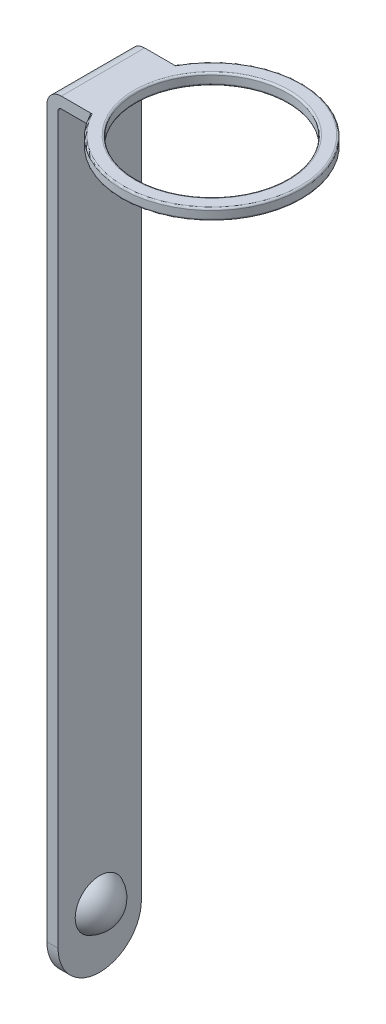
from build123d import *

# Parameters (mm, degrees)
RESSALTO_EXTRUS_O1_DEPTH   = 2.32
CORTE_EXTRUS_O1_DEPTH      = 2.32
FILETE1_R                  = 0.2
RESSALTO_EXTRUS_O2_DEPTH   = 0.1
RESSALTO_EXTRUS_O2_2_DEPTH = 0.1
RESSALTO_EXTRUS_O2_3_DEPTH = 0.1
RESSALTO_EXTRUS_O2_4_DEPTH = 0.1
RESSALTO_EXTRUS_O2_5_DEPTH = 0.1
RESSALTO_EXTRUS_O2_6_DEPTH = 0.1
RESSALTO_EXTRUS_O2_7_DEPTH = 0.1
RESSALTO_EXTRUS_O2_8_DEPTH = 0.1
RESSALTO_EXTRUS_O2_9_DEPTH = 0.1
ESCALA1_SCALE              = 0.85


with BuildPart() as part:
    # Esboço1 → Revolução1 (revolve)
    with BuildSketch(Plane.XY, mode=Mode.PRIVATE) as revolu_o1_sk:
        with BuildLine():
            Line((-4.92, 0), (-4.32, 0))
            ThreePointArc((-4.32, 0), (-4.249289322, -0.029289322), (-4.22, -0.1))
            Line((-4.22, -0.1), (-4.22, -0.52))
            ThreePointArc((-4.22, -0.52), (-4.249289322, -0.590710678), (-4.32, -0.62))
            Line((-4.32, -0.62), (-4.92, -0.62))
            ThreePointArc((-4.92, -0.62), (-4.990710678, -0.590710678), (-5.02, -0.52))
            Line((-5.02, -0.52), (-5.02, -0.1))
            ThreePointArc((-5.02, -0.1), (-4.990710678, -0.029289322), (-4.92, 0))
        make_face()
    revolve(revolu_o1_sk.sketch.rotate(Axis((0, 0, 0), (0, -1, 0)), 270), axis=Axis((0, 0, 0), (0, -1, 0)))

    # Esboço2 → Ressalto-extrusão1 (add, symmetric)
    with BuildSketch(Plane.XY):
        with BuildLine():
            Line((-4.32, 0), (-6.06, 0))
            ThreePointArc((-6.06, 0), (-6.625685425, -0.234314575), (-6.86, -0.8))
            Line((-6.86, -0.8), (-6.86, -43.5))
            Line((-6.86, -43.5), (-6.24, -43.5))
            Line((-6.24, -43.5), (-6.24, -0.8))
            ThreePointArc((-6.24, -0.8), (-6.187279221, -0.672720779), (-6.06, -0.62))
            Line((-6.06, -0.62), (-4.32, -0.62))
            Line((-4.32, -0.62), (-4.32, 0))
        make_face()
    extrude(amount=RESSALTO_EXTRUS_O1_DEPTH, both=True)

    # Esboço3 → Corte-extrusão1 (cut, symmetric)
    with BuildSketch(Plane.ZY.offset(6.86)):
        with BuildLine():
            Line((-2.32, -41.18), (-5, -41.18))
            Line((-5, -41.18), (-5, -44.5))
            Line((-5, -44.5), (5, -44.5))
            Line((5, -44.5), (5, -41.18))
            Line((5, -41.18), (2.32, -41.18))
            ThreePointArc((2.32, -41.18), (0, -43.5), (-2.32, -41.18))
        make_face()
    extrude(amount=CORTE_EXTRUS_O1_DEPTH, both=True, mode=Mode.SUBTRACT)

    # Esboço4 → Revolução2 (revolve)
    with BuildSketch(Plane.XY):
        with BuildLine():
            Line((-6.24, -40.2), (-5.34, -40.2))
            ThreePointArc((-5.34, -40.2), (-5.58525, -41.0175), (-6.24, -41.565))
            Line((-6.24, -41.565), (-6.46, -41.565))
            Line((-6.46, -41.565), (-6.46, -40.2))
            Line((-6.46, -40.2), (-6.24, -40.2))
        make_face()
    revolve(axis=Axis((-6.24, -40.2, 0), (1, 0, 0)))

    # Esboço5 → Corte-Revolução1 (revolve, cut)
    with BuildSketch(Plane.XY):
        with BuildLine():
            Line((-6.548633208, -41.145528188), (-7.178811476, -41.32980521))
            Line((-7.178811476, -41.32980521), (-7.176947214, -40.2))
            Line((-7.176947214, -40.2), (-5.84, -40.2))
            ThreePointArc((-5.84, -40.2), (-6.036819779, -40.790801273), (-6.548633208, -41.145528188))
        make_face()
    revolve(axis=Axis((-5.84, -40.2, 0), (-1, 0, 0)), mode=Mode.SUBTRACT)

    # Filete1
    filete1_edges = [part.edges().sort_by_distance(p)[0] for p in [
        (-6.86, -39.16342179, 0),
    ]]
    fillet(filete1_edges, radius=FILETE1_R)


with BuildPart() as body_2:
    # Esboço7 → Ressalto-extrusão2 (new, symmetric)
    with BuildSketch(Plane.ZY.offset(6.86)):
        with BuildLine():
            Line((1.020851484, -19.865331757), (0.742596737, -19.76920739))
            add(Edge.make_bspline(
                [(0.742596737, -19.76920739), (0.757593957, -19.806355131), (0.786687829, -19.878419925), (0.825031677, -19.984742232), (0.857678095, -20.085518966), (0.884393745, -20.180849175), (0.90520856, -20.27059076), (0.920147156, -20.354857607), (0.929573432, -20.433711748), (0.930856164, -20.484636158), (0.931472686, -20.509112057)],
                knots=[0, 0, 0, 0, 0.156478262, 0.303560144, 0.441403194, 0.570198865, 0.690181929, 0.801102155, 0.904403337, 1, 1, 1, 1], degree=3))
            add(Edge.make_bspline(
                [(0.931472686, -20.509112057), (0.930863484, -20.533599164), (0.929688427, -20.580831029), (0.919659265, -20.648690082), (0.90243485, -20.710357768), (0.878400099, -20.765868408), (0.847209355, -20.81505198), (0.809364233, -20.858194841), (0.764244027, -20.894866274), (0.712604498, -20.92533672), (0.654422599, -20.948414271), (0.590471733, -20.964116777), (0.520743778, -20.971290684), (0.44547422, -20.971022615), (0.364479407, -20.963236419), (0.278056645, -20.947153581), (0.185734386, -20.924015136), (0.123279398, -20.903178626), (0.090806072, -20.892344732)],
                knots=[0, 0, 0, 0, 0.064741831, 0.12487704, 0.18088471, 0.233644607, 0.284273212, 0.334308944, 0.384755763, 0.437409504, 0.492280856, 0.54970497, 0.611027667, 0.677187925, 0.748494668, 0.825921597, 0.909488339, 1, 1, 1, 1], degree=3))
            add(Edge.make_bspline(
                [(0.090806072, -20.892344732), (0.056650445, -20.880073255), (-0.010213215, -20.856050394), (-0.105896758, -20.81442944), (-0.195604581, -20.770351986), (-0.278880492, -20.722693472), (-0.35574384, -20.671648161), (-0.426513389, -20.617495695), (-0.491298393, -20.560371112), (-0.548882041, -20.499414701), (-0.600619058, -20.436654781), (-0.645397844, -20.371796368), (-0.682966188, -20.305171044), (-0.714727722, -20.237488229), (-0.738770659, -20.167781459), (-0.755441338, -20.096407833), (-0.766651633, -20.023644123), (-0.767821803, -19.974426924), (-0.768410858, -19.949651377)],
                knots=[0, 0, 0, 0, 0.079810182, 0.156237826, 0.22936628, 0.299567533, 0.36712409, 0.432164324, 0.495441274, 0.556879497, 0.616406191, 0.67419565, 0.729981172, 0.784472221, 0.838432893, 0.891814982, 0.945540522, 1, 1, 1, 1], degree=3))
            add(Edge.make_bspline(
                [(-0.768410858, -19.949651377), (-0.767960921, -19.929822007), (-0.767011201, -19.887966417), (-0.760157699, -19.821984823), (-0.749596434, -19.749554797), (-0.73461293, -19.670558166), (-0.715598755, -19.585083339), (-0.692283055, -19.493171966), (-0.664819841, -19.394786041), (-0.64418831, -19.327328524), (-0.633499466, -19.292379937)],
                knots=[0, 0, 0, 0, 0.088369929, 0.186530149, 0.295393245, 0.414553327, 0.544787577, 0.685609019, 0.837119402, 1, 1, 1, 1], degree=3))
            Line((-0.633499466, -19.292379937), (-0.947168453, -19.184029225))
            add(Edge.make_bspline(
                [(-0.947168453, -19.184029225), (-0.954496888, -19.21575444), (-0.96889101, -19.278067416), (-0.987316093, -19.370313016), (-1.003050969, -19.459277237), (-1.015581551, -19.544926988), (-1.025950312, -19.627265243), (-1.03305992, -19.706432132), (-1.037543469, -19.782364577), (-1.038007205, -19.831879156), (-1.038233643, -19.856056599)],
                knots=[0, 0, 0, 0, 0.143721631, 0.28229036, 0.415178753, 0.542474965, 0.66435352, 0.781452797, 0.893285726, 1, 1, 1, 1], degree=3))
            add(Edge.make_bspline(
                [(-1.038233643, -19.856056599), (-1.037372979, -19.896993805), (-1.035670243, -19.977983946), (-1.021212955, -20.097360542), (-0.998761011, -20.213251995), (-0.966072598, -20.325015148), (-0.924566678, -20.433212504), (-0.873964723, -20.537555307), (-0.81358392, -20.637942545), (-0.74455896, -20.734162161), (-0.667533141, -20.825731644), (-0.582317812, -20.911116288), (-0.489876772, -20.99051113), (-0.389723132, -21.063586009), (-0.282654271, -21.131166291), (-0.167810221, -21.192208076), (-0.04590438, -21.247935345), (0.039416301, -21.278837702), (0.082795709, -21.29454932)],
                knots=[0, 0, 0, 0, 0.062770809, 0.124185723, 0.184171926, 0.243656045, 0.302541562, 0.361734005, 0.421287993, 0.482002513, 0.543190042, 0.604615169, 0.666829468, 0.729904136, 0.794611786, 0.860862787, 0.929258769, 1, 1, 1, 1], degree=3))
            add(Edge.make_bspline(
                [(0.082795709, -21.29454932), (0.104667683, -21.302015478), (0.147624593, -21.316679131), (0.211646496, -21.335540827), (0.273815662, -21.351647393), (0.334014839, -21.365020438), (0.392262556, -21.376473927), (0.44879566, -21.383515864), (0.503282228, -21.389693812), (0.556090338, -21.391212691), (0.606908994, -21.391912093), (0.655831726, -21.387924403), (0.702981861, -21.383072477), (0.748121937, -21.373922314), (0.791345399, -21.362534599), (0.832753796, -21.348783038), (0.872199645, -21.331773307), (0.909643668, -21.311952677), (0.945139098, -21.289699914), (0.978186811, -21.264614158), (1.009050678, -21.237120667), (1.037810206, -21.207208799), (1.064116233, -21.174432032), (1.088006028, -21.13914032), (1.109613696, -21.10132392), (1.128979836, -21.061151363), (1.146424733, -21.018433311), (1.161032496, -20.973008562), (1.173059092, -20.925040061), (1.183873511, -20.87477936), (1.191704631, -20.821822264), (1.197084184, -20.766235738), (1.200507574, -20.708289395), (1.201029868, -20.668761997), (1.201295471, -20.648661029)],
                knots=[0, 0, 0, 0, 0.043008507, 0.084469397, 0.124180755, 0.162507098, 0.199235706, 0.234597893, 0.268508446, 0.301228061, 0.332875341, 0.363026025, 0.392516044, 0.421035546, 0.448632244, 0.475678105, 0.502156506, 0.52848074, 0.554458372, 0.580037958, 0.605602831, 0.631315783, 0.657171999, 0.683722641, 0.710551374, 0.738157985, 0.766667892, 0.79636134, 0.826874001, 0.858677607, 0.892005197, 0.92643625, 0.96259044, 1, 1, 1, 1], degree=3))
            add(Edge.make_bspline(
                [(1.201295471, -20.648661029), (1.200693782, -20.616882032), (1.199483041, -20.552935124), (1.190643247, -20.456672676), (1.176900327, -20.359511702), (1.156843715, -20.261764126), (1.131682563, -20.163309348), (1.10000971, -20.064437228), (1.063700571, -19.964532602), (1.035240248, -19.898643496), (1.020851484, -19.865331757)],
                knots=[0, 0, 0, 0, 0.117722206, 0.236885105, 0.357859754, 0.481103153, 0.606371041, 0.734148831, 0.865592885, 1, 1, 1, 1], degree=3))
        make_face()
    extrude(amount=RESSALTO_EXTRUS_O2_DEPTH, both=True)


with BuildPart() as body_3:
    # Esboço7 → Ressalto-extrus_o2 2 (new, symmetric)
    with BuildSketch(Plane.ZY.offset(6.86)):
        Polygon((1.147330914, -17.183967833), (1.147330914, -16.860180491), (-0.573632535, -16.264462374), (1.012419522, -16.324329304), (1.012419522, -15.984942833), (-0.483410541, -14.946546709), (1.147330914, -15.511066567), (1.147330914, -15.160296947), (-0.984269086, -14.422078671), (-0.984269086, -14.849157548), (0.599674981, -15.988737216), (-0.984269086, -15.973138086), (-0.984269086, -16.445749557), align=None)
    extrude(amount=RESSALTO_EXTRUS_O2_2_DEPTH, both=True)


with BuildPart() as body_4:
    # Esboço7 → Ressalto-extrus_o2 3 (new, symmetric)
    with BuildSketch(Plane.ZY.offset(6.86)):
        with BuildLine():
            Line((1.147330914, -14.647633656), (1.147330914, -14.269881757))
            Line((1.147330914, -14.269881757), (0.310880281, -13.980243861))
            Line((0.310880281, -13.980243861), (0.310880281, -13.904777801))
            add(Edge.make_bspline(
                [(0.310880281, -13.904777801), (0.310361373, -13.870045477), (0.309340534, -13.801717191), (0.29986038, -13.701139008), (0.284264456, -13.604403601), (0.262846316, -13.511210694), (0.235037933, -13.421874099), (0.201154893, -13.336152333), (0.161134695, -13.254148986), (0.114634652, -13.17645402), (0.063689237, -13.103051479), (0.007103352, -13.036035766), (-0.05255704, -12.974035198), (-0.117244837, -12.918562648), (-0.185805634, -12.868723312), (-0.259033883, -12.825179927), (-0.33594974, -12.786823917), (-0.390033182, -12.766821107), (-0.41721964, -12.756766171)],
                knots=[0, 0, 0, 0, 0.071615387, 0.14088768, 0.208118212, 0.273570435, 0.337921911, 0.400890572, 0.463496012, 0.525875639, 0.587465896, 0.64754421, 0.706571715, 0.764728301, 0.823049311, 0.881153877, 0.940258887, 1, 1, 1, 1], degree=3))
            add(Edge.make_bspline(
                [(-0.41721964, -12.756766171), (-0.435965533, -12.750571497), (-0.47213139, -12.738620308), (-0.526033755, -12.72600555), (-0.577313408, -12.717799326), (-0.626002077, -12.714172577), (-0.672228632, -12.71586746), (-0.715759795, -12.722172289), (-0.757010458, -12.732773229), (-0.782451454, -12.744049632), (-0.794971538, -12.749599004)],
                knots=[0, 0, 0, 0, 0.152709627, 0.294617841, 0.427812724, 0.554257621, 0.671783736, 0.784973558, 0.894180667, 1, 1, 1, 1], degree=3))
            add(Edge.make_bspline(
                [(-0.794971538, -12.749599004), (-0.803266079, -12.753862369), (-0.819800159, -12.762360829), (-0.842014125, -12.779272715), (-0.863044524, -12.798002962), (-0.882445467, -12.819269539), (-0.899221094, -12.843853652), (-0.914910389, -12.870379375), (-0.928891575, -12.899523725), (-0.940593812, -12.931671993), (-0.951297243, -12.966795958), (-0.959910109, -13.005746775), (-0.967453043, -13.048370304), (-0.973833008, -13.094765326), (-0.978281612, -13.145142642), (-0.981600618, -13.199268322), (-0.983737646, -13.257327089), (-0.984087862, -13.297253053), (-0.984269086, -13.317913244)],
                knots=[0, 0, 0, 0, 0.044358331, 0.088422526, 0.132522324, 0.178513533, 0.225143808, 0.274068847, 0.325286517, 0.378895433, 0.436942126, 0.500133654, 0.568833053, 0.643175244, 0.723202219, 0.809751832, 0.901553696, 1, 1, 1, 1], degree=3))
            Line((-0.984269086, -13.317913244), (-0.984269086, -13.90941538))
            Line((-0.984269086, -13.90941538), (1.147330914, -14.647633656))
        make_face()
        with BuildLine():
            Line((-0.714446301, -13.62525826), (0.041057496, -13.886649083))
            Line((0.041057496, -13.886649083), (0.041057496, -13.82509576))
            add(Edge.make_bspline(
                [(0.041057496, -13.82509576), (0.040786774, -13.805126076), (0.040255689, -13.765950938), (0.034505703, -13.708364518), (0.025712603, -13.653022355), (0.013685764, -13.599800625), (-0.002478516, -13.549125597), (-0.021864376, -13.500684181), (-0.045106432, -13.454766153), (-0.071720699, -13.411177375), (-0.10164288, -13.37029523), (-0.134669454, -13.332266149), (-0.17046897, -13.296918087), (-0.210090483, -13.26560771), (-0.251763798, -13.236021517), (-0.296984018, -13.210580039), (-0.34506609, -13.187937687), (-0.37861471, -13.175453619), (-0.395718136, -13.169089114)],
                knots=[0, 0, 0, 0, 0.070734038, 0.138761124, 0.204822692, 0.269202109, 0.331877967, 0.393088877, 0.453881157, 0.514000862, 0.573856049, 0.633157761, 0.692312961, 0.751802515, 0.811889219, 0.873217482, 0.93536499, 1, 1, 1, 1], degree=3))
            add(Edge.make_bspline(
                [(-0.395718136, -13.169089114), (-0.409435178, -13.164690961), (-0.435651676, -13.156285054), (-0.473919658, -13.14713992), (-0.509418249, -13.142787655), (-0.541884309, -13.142530293), (-0.571288036, -13.146722275), (-0.597847449, -13.15467069), (-0.621271112, -13.167413265), (-0.641665785, -13.184888482), (-0.659128873, -13.207035333), (-0.674418334, -13.2339899), (-0.686811035, -13.266295459), (-0.69677676, -13.303784989), (-0.704581682, -13.346370567), (-0.710503223, -13.39422095), (-0.713668266, -13.447301273), (-0.714179363, -13.484440678), (-0.714446301, -13.503838007)],
                knots=[0, 0, 0, 0, 0.072878532, 0.139288046, 0.198735024, 0.253488662, 0.303066213, 0.348497889, 0.393047313, 0.43693349, 0.483464833, 0.535061476, 0.59316205, 0.658023093, 0.731102555, 0.812069643, 0.901846917, 1, 1, 1, 1], degree=3))
            Line((-0.714446301, -13.503838007), (-0.714446301, -13.62525826))
        make_face(mode=Mode.SUBTRACT)
    extrude(amount=RESSALTO_EXTRUS_O2_3_DEPTH, both=True)


with BuildPart() as body_5:
    # Esboço7 → Ressalto-extrus_o2 4 (new, symmetric)
    with BuildSketch(Plane.ZY.offset(6.86)):
        Polygon((1.147330914, -13.244555175), (1.147330914, -12.913600665), (0.580703066, -12.49284576), (0.580703066, -11.665248687), (1.147330914, -11.639109605), (1.147330914, -11.247866567), (-0.984269086, -11.32712701), (-0.984269086, -11.678739826), align=None)
        Polygon((0.310880281, -11.664405491), (-0.549601443, -11.688858181), (0.310880281, -12.305656203), align=None, mode=Mode.SUBTRACT)
    extrude(amount=RESSALTO_EXTRUS_O2_4_DEPTH, both=True)


with BuildPart() as body_6:
    # Esboço7 → Ressalto-extrus_o2 5 (new, symmetric)
    with BuildSketch(Plane.ZY.offset(6.86)):
        with BuildLine():
            Line((1.020851484, -9.288278592), (0.742596737, -9.192154225))
            add(Edge.make_bspline(
                [(0.742596737, -9.192154225), (0.757593957, -9.229301966), (0.786687829, -9.30136676), (0.825031677, -9.407689067), (0.857678095, -9.508465802), (0.884393745, -9.60379601), (0.90520856, -9.693537595), (0.920147156, -9.777804442), (0.929573432, -9.856658583), (0.930856164, -9.907582993), (0.931472686, -9.932058893)],
                knots=[0, 0, 0, 0, 0.156478262, 0.303560144, 0.441403194, 0.570198865, 0.690181929, 0.801102155, 0.904403337, 1, 1, 1, 1], degree=3))
            add(Edge.make_bspline(
                [(0.931472686, -9.932058893), (0.930863484, -9.956546), (0.929688427, -10.003777864), (0.919659265, -10.071636917), (0.90243485, -10.133304603), (0.878400099, -10.188815243), (0.847209355, -10.237998816), (0.809364233, -10.281141677), (0.764244027, -10.31781311), (0.712604498, -10.348283555), (0.654422599, -10.371361106), (0.590471733, -10.387063613), (0.520743778, -10.394237519), (0.44547422, -10.39396945), (0.364479407, -10.386183255), (0.278056645, -10.370100417), (0.185734386, -10.346961971), (0.123279398, -10.326125462), (0.090806072, -10.315291567)],
                knots=[0, 0, 0, 0, 0.064741831, 0.12487704, 0.18088471, 0.233644607, 0.284273212, 0.334308944, 0.384755763, 0.437409504, 0.492280856, 0.54970497, 0.611027667, 0.677187925, 0.748494668, 0.825921597, 0.909488339, 1, 1, 1, 1], degree=3))
            add(Edge.make_bspline(
                [(0.090806072, -10.315291567), (0.056650445, -10.30302009), (-0.010213215, -10.27899723), (-0.105896758, -10.237376276), (-0.195604581, -10.193298822), (-0.278880492, -10.145640308), (-0.35574384, -10.094594997), (-0.426513389, -10.040442531), (-0.491298393, -9.983317947), (-0.548882041, -9.922361536), (-0.600619058, -9.859601617), (-0.645397844, -9.794743204), (-0.682966188, -9.728117879), (-0.714727722, -9.660435065), (-0.738770659, -9.590728294), (-0.755441338, -9.519354668), (-0.766651633, -9.446590959), (-0.767821803, -9.397373759), (-0.768410858, -9.372598213)],
                knots=[0, 0, 0, 0, 0.079810182, 0.156237826, 0.22936628, 0.299567533, 0.36712409, 0.432164324, 0.495441274, 0.556879497, 0.616406191, 0.67419565, 0.729981172, 0.784472221, 0.838432893, 0.891814982, 0.945540522, 1, 1, 1, 1], degree=3))
            add(Edge.make_bspline(
                [(-0.768410858, -9.372598213), (-0.767960921, -9.352768842), (-0.767011201, -9.310913253), (-0.760157699, -9.244931658), (-0.749596434, -9.172501633), (-0.73461293, -9.093505002), (-0.715598755, -9.008030175), (-0.692283055, -8.916118802), (-0.664819841, -8.817732876), (-0.64418831, -8.75027536), (-0.633499466, -8.715326773)],
                knots=[0, 0, 0, 0, 0.088369929, 0.186530149, 0.295393245, 0.414553327, 0.544787577, 0.685609019, 0.837119402, 1, 1, 1, 1], degree=3))
            Line((-0.633499466, -8.715326773), (-0.947168453, -8.606976061))
            add(Edge.make_bspline(
                [(-0.947168453, -8.606976061), (-0.954496888, -8.638701276), (-0.96889101, -8.701014251), (-0.987316093, -8.793259851), (-1.003050969, -8.882224073), (-1.015581551, -8.967873824), (-1.025950312, -9.050212079), (-1.03305992, -9.129378967), (-1.037543469, -9.205311412), (-1.038007205, -9.254825992), (-1.038233643, -9.279003434)],
                knots=[0, 0, 0, 0, 0.143721631, 0.28229036, 0.415178753, 0.542474965, 0.66435352, 0.781452797, 0.893285726, 1, 1, 1, 1], degree=3))
            add(Edge.make_bspline(
                [(-1.038233643, -9.279003434), (-1.037372979, -9.319940641), (-1.035670243, -9.400930781), (-1.021212955, -9.520307378), (-0.998761011, -9.63619883), (-0.966072598, -9.747961984), (-0.924566678, -9.85615934), (-0.873964723, -9.960502143), (-0.81358392, -10.060889381), (-0.74455896, -10.157108996), (-0.667533141, -10.248678479), (-0.582317812, -10.334063123), (-0.489876772, -10.413457966), (-0.389723132, -10.486532845), (-0.282654271, -10.554113126), (-0.167810221, -10.615154912), (-0.04590438, -10.670882181), (0.039416301, -10.701784537), (0.082795709, -10.717496156)],
                knots=[0, 0, 0, 0, 0.062770809, 0.124185723, 0.184171926, 0.243656045, 0.302541562, 0.361734005, 0.421287993, 0.482002513, 0.543190042, 0.604615169, 0.666829468, 0.729904136, 0.794611786, 0.860862787, 0.929258769, 1, 1, 1, 1], degree=3))
            add(Edge.make_bspline(
                [(0.082795709, -10.717496156), (0.104667683, -10.724962313), (0.147624593, -10.739625966), (0.211646496, -10.758487663), (0.273815662, -10.774594229), (0.334014839, -10.787967274), (0.392262556, -10.799420762), (0.44879566, -10.806462699), (0.503282228, -10.812640647), (0.556090338, -10.814159527), (0.606908994, -10.814858928), (0.655831726, -10.810871239), (0.702981861, -10.806019313), (0.748121937, -10.79686915), (0.791345399, -10.785481435), (0.832753796, -10.771729874), (0.872199645, -10.754720143), (0.909643668, -10.734899512), (0.945139098, -10.71264675), (0.978186811, -10.687560994), (1.009050678, -10.660067502), (1.037810206, -10.630155635), (1.064116233, -10.597378867), (1.088006028, -10.562087155), (1.109613696, -10.524270756), (1.128979836, -10.484098199), (1.146424733, -10.441380146), (1.161032496, -10.395955397), (1.173059092, -10.347986897), (1.183873511, -10.297726196), (1.191704631, -10.244769099), (1.197084184, -10.189182573), (1.200507574, -10.131236231), (1.201029868, -10.091708832), (1.201295471, -10.071607864)],
                knots=[0, 0, 0, 0, 0.043008507, 0.084469397, 0.124180755, 0.162507098, 0.199235706, 0.234597893, 0.268508446, 0.301228061, 0.332875341, 0.363026025, 0.392516044, 0.421035546, 0.448632244, 0.475678105, 0.502156506, 0.52848074, 0.554458372, 0.580037958, 0.605602831, 0.631315783, 0.657171999, 0.683722641, 0.710551374, 0.738157985, 0.766667892, 0.79636134, 0.826874001, 0.858677607, 0.892005197, 0.92643625, 0.96259044, 1, 1, 1, 1], degree=3))
            add(Edge.make_bspline(
                [(1.201295471, -10.071607864), (1.200693782, -10.039828867), (1.199483041, -9.975881959), (1.190643247, -9.879619512), (1.176900327, -9.782458537), (1.156843715, -9.684710961), (1.131682563, -9.586256183), (1.10000971, -9.487384064), (1.063700571, -9.387479438), (1.035240248, -9.321590331), (1.020851484, -9.288278592)],
                knots=[0, 0, 0, 0, 0.117722206, 0.236885105, 0.357859754, 0.481103153, 0.606371041, 0.734148831, 0.865592885, 1, 1, 1, 1], degree=3))
        make_face()
    extrude(amount=RESSALTO_EXTRUS_O2_5_DEPTH, both=True)


with BuildPart() as body_7:
    # Esboço7 → Ressalto-extrus_o2 6 (new, symmetric)
    with BuildSketch(Plane.ZY.offset(6.86)):
        Polygon((1.147330914, -8.414727326), (1.147330914, -8.036975428), (-0.714446301, -7.392351931), (-0.714446301, -6.663830412), (-0.984269086, -6.570235633), (-0.984269086, -8.40503057), (-0.714446301, -8.498625349), (-0.714446301, -7.77010383), align=None)
    extrude(amount=RESSALTO_EXTRUS_O2_6_DEPTH, both=True)


with BuildPart() as body_8:
    # Esboço7 → Ressalto-extrus_o2 7 (new, symmetric)
    with BuildSketch(Plane.ZY.offset(6.86)):
        with BuildLine():
            Line((1.147330914, -4.745137453), (1.147330914, -4.367385554))
            Line((1.147330914, -4.367385554), (0.256915724, -4.059197342))
            Line((0.256915724, -4.059197342), (0.256915724, -3.845868703))
            Line((0.256915724, -3.845868703), (1.147330914, -3.581105095))
            Line((1.147330914, -3.581105095), (1.147330914, -3.153183023))
            Line((1.147330914, -3.153183023), (0.145192227, -3.476548766))
            add(Edge.make_bspline(
                [(0.145192227, -3.476548766), (0.131638145, -3.442596572), (0.104491096, -3.374594778), (0.049527012, -3.278902592), (-0.014798246, -3.187942567), (-0.076904895, -3.117670924), (-0.130204877, -3.064522531), (-0.172136993, -3.027769938), (-0.215134037, -2.994092305), (-0.259079913, -2.963107502), (-0.30429124, -2.935263383), (-0.350644811, -2.910264753), (-0.398334839, -2.88874078), (-0.430917524, -2.876708062), (-0.447153105, -2.870712295)],
                knots=[0, 0, 0, 0, 0.125369655, 0.251098982, 0.377738644, 0.507315408, 0.572475916, 0.636061701, 0.698602939, 0.759905576, 0.820559288, 0.880781651, 0.940594855, 1, 1, 1, 1], degree=3))
            add(Edge.make_bspline(
                [(-0.447153105, -2.870712295), (-0.467559625, -2.86412352), (-0.506679236, -2.85149274), (-0.564920348, -2.839710576), (-0.619715062, -2.833801606), (-0.671224184, -2.83479599), (-0.71931671, -2.842976756), (-0.764108843, -2.857202245), (-0.80536021, -2.878542842), (-0.842877519, -2.906338569), (-0.876603101, -2.940479732), (-0.905635047, -2.981300101), (-0.930095617, -3.028350705), (-0.950499641, -3.081308491), (-0.965094995, -3.140896075), (-0.97656708, -3.206215265), (-0.98327622, -3.277977836), (-0.983928744, -3.327851025), (-0.984269086, -3.353863719)],
                knots=[0, 0, 0, 0, 0.071518207, 0.137101491, 0.197910835, 0.255147926, 0.308428079, 0.360192092, 0.411374899, 0.46268648, 0.515418836, 0.570867801, 0.629191812, 0.691992513, 0.759790694, 0.833582672, 0.913200595, 1, 1, 1, 1], degree=3))
            Line((-0.984269086, -3.353863719), (-0.984269086, -4.006919178))
            Line((-0.984269086, -4.006919178), (1.147330914, -4.745137453))
        make_face()
        with BuildLine():
            Line((-0.714446301, -3.722762057), (-0.01290706, -3.965602564))
            Line((-0.01290706, -3.965602564), (-0.01290706, -3.924707548))
            add(Edge.make_bspline(
                [(-0.01290706, -3.924707548), (-0.013251373, -3.903338599), (-0.013922712, -3.86167343), (-0.018561011, -3.800565014), (-0.02650023, -3.742404012), (-0.037711159, -3.687127564), (-0.052731811, -3.634970347), (-0.070181035, -3.585482937), (-0.091436355, -3.539069326), (-0.115380592, -3.495312883), (-0.142989565, -3.454853475), (-0.173225888, -3.41698804), (-0.207271222, -3.383006123), (-0.243666821, -3.351383779), (-0.283285032, -3.323300751), (-0.325870645, -3.298204807), (-0.371431841, -3.276200018), (-0.403484314, -3.264233378), (-0.419749228, -3.25816095)],
                knots=[0, 0, 0, 0, 0.076297795, 0.148765413, 0.218665046, 0.285780609, 0.349950318, 0.412327316, 0.472958284, 0.532028471, 0.590203132, 0.647646062, 0.704772523, 0.761702511, 0.819625595, 0.877886754, 0.938034067, 1, 1, 1, 1], degree=3))
            add(Edge.make_bspline(
                [(-0.419749228, -3.25816095), (-0.431638686, -3.254452629), (-0.454344566, -3.247370667), (-0.487881806, -3.240253266), (-0.51925741, -3.23803701), (-0.548317906, -3.240209532), (-0.575302879, -3.245749912), (-0.599786705, -3.256685572), (-0.621847111, -3.271569188), (-0.641767399, -3.290598639), (-0.658788511, -3.314088366), (-0.674290185, -3.341383543), (-0.68661117, -3.373123658), (-0.696729134, -3.409006566), (-0.704490553, -3.448933517), (-0.710492323, -3.493116905), (-0.713649236, -3.54142899), (-0.714174209, -3.575058241), (-0.714446301, -3.592488244)],
                knots=[0, 0, 0, 0, 0.067326688, 0.128577078, 0.184937371, 0.236749591, 0.28579066, 0.333087511, 0.380718921, 0.429090152, 0.481219031, 0.537018153, 0.598400386, 0.664785637, 0.738405109, 0.818146816, 0.9057457, 1, 1, 1, 1], degree=3))
            Line((-0.714446301, -3.592488244), (-0.714446301, -3.722762057))
        make_face(mode=Mode.SUBTRACT)
    extrude(amount=RESSALTO_EXTRUS_O2_7_DEPTH, both=True)


with BuildPart() as body_9:
    # Esboço7 → Ressalto-extrus_o2 8 (new, symmetric)
    with BuildSketch(Plane.ZY.offset(6.86)):
        with BuildLine():
            add(Edge.make_bspline(
                [(1.201295471, -18.632578909), (1.200504882, -18.593458935), (1.198937817, -18.515917357), (1.18334124, -18.401310584), (1.159753745, -18.289420554), (1.125037849, -18.180703731), (1.081652963, -18.074520923), (1.02829364, -17.971175559), (0.964626869, -17.871228316), (0.892326042, -17.774546624), (0.812058966, -17.682731535), (0.725420794, -17.596522503), (0.633117506, -17.516571073), (0.534328704, -17.443969938), (0.429946126, -17.37763437), (0.319597594, -17.317622692), (0.203251577, -17.264275603), (0.122360876, -17.23472133), (0.081530914, -17.219803671)],
                knots=[0, 0, 0, 0, 0.060936038, 0.120784245, 0.179938702, 0.238957169, 0.298380653, 0.358527094, 0.41995865, 0.482862114, 0.546507798, 0.609850898, 0.673209521, 0.736640409, 0.800742718, 0.865820563, 0.932272297, 1, 1, 1, 1], degree=3))
            add(Edge.make_bspline(
                [(0.081530914, -17.219803671), (0.061055412, -17.212926999), (0.020723615, -17.199381615), (-0.0394299, -17.181671194), (-0.098247453, -17.166898454), (-0.155482129, -17.154655869), (-0.211306527, -17.144912555), (-0.265574876, -17.137572778), (-0.31849873, -17.133476396), (-0.369852096, -17.131566962), (-0.419818374, -17.132948268), (-0.468225265, -17.136705184), (-0.515310462, -17.142851038), (-0.560660993, -17.152419604), (-0.604973381, -17.163407279), (-0.647268491, -17.178522805), (-0.688564036, -17.195246214), (-0.728025872, -17.214998299), (-0.765495221, -17.237473507), (-0.801091715, -17.26163987), (-0.83370513, -17.289025601), (-0.864062097, -17.318428726), (-0.892018369, -17.350355306), (-0.91793849, -17.384340903), (-0.940452069, -17.421369824), (-0.961420726, -17.460179424), (-0.9793461, -17.50176977), (-0.995565243, -17.545416157), (-1.008387308, -17.591770433), (-1.01947805, -17.640127537), (-1.027733853, -17.691126437), (-1.034223137, -17.744266389), (-1.037405869, -17.800024183), (-1.037953119, -17.837863415), (-1.038233643, -17.857260001)],
                knots=[0, 0, 0, 0, 0.040889718, 0.080542876, 0.118679111, 0.155676299, 0.191324916, 0.22594297, 0.259306308, 0.291782665, 0.323187498, 0.353877571, 0.383678295, 0.413002521, 0.441589689, 0.470029145, 0.497944818, 0.525906097, 0.553465768, 0.580624409, 0.607263314, 0.633980492, 0.660560873, 0.687539073, 0.714782289, 0.74251479, 0.770987828, 0.800446923, 0.830597144, 0.861965893, 0.894333085, 0.928357147, 0.963275503, 1, 1, 1, 1], degree=3))
            add(Edge.make_bspline(
                [(-1.038233643, -17.857260001), (-1.037378631, -17.894686299), (-1.035678315, -17.969114048), (-1.02089732, -18.079484121), (-0.996663209, -18.187450504), (-0.963553386, -18.293355585), (-0.919530087, -18.396256278), (-0.867205238, -18.497366859), (-0.804409626, -18.595502883), (-0.732931463, -18.690872869), (-0.65376269, -18.781792491), (-0.567639972, -18.867014031), (-0.475345107, -18.945982611), (-0.376132909, -19.018136585), (-0.271094964, -19.08439994), (-0.159707499, -19.144433803), (-0.042004895, -19.198272602), (0.039997383, -19.22827737), (0.081530914, -19.243474557)],
                knots=[0, 0, 0, 0, 0.059012109, 0.117354338, 0.175272684, 0.233388775, 0.292095362, 0.351581399, 0.412766547, 0.475629504, 0.539416165, 0.602738973, 0.666571834, 0.730814028, 0.796062862, 0.862314167, 0.93026317, 1, 1, 1, 1], degree=3))
            add(Edge.make_bspline(
                [(0.081530914, -19.243474557), (0.102431421, -19.250479997), (0.143485066, -19.264240373), (0.204592214, -19.282466547), (0.264265979, -19.297594538), (0.322282683, -19.310455031), (0.378915185, -19.319883236), (0.433680813, -19.327785363), (0.487025272, -19.332532295), (0.538806846, -19.333880153), (0.589076705, -19.334053588), (0.637579701, -19.329750194), (0.684539392, -19.324270113), (0.729827736, -19.315176833), (0.773630769, -19.303874735), (0.816003181, -19.29007648), (0.856564708, -19.272947429), (0.895724041, -19.253789367), (0.932713, -19.231826886), (0.967581161, -19.207841559), (0.99959815, -19.181017327), (1.029646482, -19.152452495), (1.057224255, -19.121385872), (1.082494347, -19.088148845), (1.1052883, -19.052605013), (1.125713677, -19.01488976), (1.143199414, -18.974702171), (1.158960241, -18.932556226), (1.17191248, -18.887974022), (1.182926887, -18.841283802), (1.191290842, -18.792279473), (1.197188568, -18.741051958), (1.200481847, -18.68757076), (1.201020949, -18.651133547), (1.201295471, -18.632578909)],
                knots=[0, 0, 0, 0, 0.042195995, 0.082883127, 0.122031908, 0.160023907, 0.196599869, 0.231906236, 0.265931797, 0.29903886, 0.331053478, 0.362085479, 0.392183375, 0.421517758, 0.450423424, 0.478752488, 0.506730661, 0.534642795, 0.56214089, 0.589006638, 0.615563511, 0.642011153, 0.668306484, 0.694993845, 0.721858246, 0.749061301, 0.777004532, 0.805689023, 0.83514159, 0.865811153, 0.89747801, 0.930246699, 0.964480071, 1, 1, 1, 1], degree=3))
        make_face()
        with BuildLine():
            add(Edge.make_bspline(
                [(-0.768410858, -17.950854779), (-0.767754839, -17.973235269), (-0.766444357, -18.017943206), (-0.756062571, -18.084411391), (-0.738648133, -18.149634962), (-0.714244089, -18.213777041), (-0.683467641, -18.277060484), (-0.645678614, -18.339214078), (-0.601046651, -18.400215556), (-0.54972183, -18.45982902), (-0.491998866, -18.517363541), (-0.428491846, -18.57252971), (-0.358694453, -18.624238696), (-0.282988467, -18.673333419), (-0.201120087, -18.718973953), (-0.113619312, -18.762271045), (-0.019810783, -18.801735017), (0.045307684, -18.825389443), (0.078579727, -18.837475586)],
                knots=[0, 0, 0, 0, 0.051347472, 0.102573243, 0.153973362, 0.20603008, 0.259834966, 0.315259831, 0.37274026, 0.433121849, 0.495611555, 0.559632345, 0.626009729, 0.694805905, 0.766577084, 0.841006559, 0.918762883, 1, 1, 1, 1], degree=3))
            add(Edge.make_bspline(
                [(0.078579727, -18.837475586), (0.111900091, -18.848715568), (0.176075731, -18.870363982), (0.270704015, -18.894872771), (0.358937477, -18.913748951), (0.441445191, -18.924216038), (0.517862922, -18.928494644), (0.58840181, -18.925346909), (0.652891662, -18.915088238), (0.711287242, -18.897460245), (0.762941243, -18.872823015), (0.808462965, -18.842949187), (0.846572133, -18.806301284), (0.878111165, -18.764266791), (0.902512982, -18.716193992), (0.918963553, -18.662250765), (0.929913187, -18.602804845), (0.930939019, -18.5611012), (0.931472686, -18.539405728)],
                knots=[0, 0, 0, 0, 0.096204939, 0.185292501, 0.267356505, 0.342966399, 0.412664136, 0.476581037, 0.535824932, 0.59093489, 0.642887996, 0.691955171, 0.739286953, 0.786822984, 0.835155144, 0.885997409, 0.940692475, 1, 1, 1, 1], degree=3))
            add(Edge.make_bspline(
                [(0.931472686, -18.539405728), (0.930854539, -18.515337412), (0.929623073, -18.46738877), (0.918783528, -18.396436304), (0.900867276, -18.327173625), (0.876211644, -18.259459702), (0.845108317, -18.193059677), (0.80620016, -18.128626791), (0.760554885, -18.065801703), (0.708113001, -18.004763993), (0.649722468, -17.945747713), (0.584835641, -17.890225442), (0.514774139, -17.83725059), (0.438494825, -17.788027105), (0.356750619, -17.741624487), (0.269156797, -17.69883212), (0.176341993, -17.658367955), (0.111608799, -17.635129899), (0.078579727, -17.623273054)],
                knots=[0, 0, 0, 0, 0.054002317, 0.107582837, 0.160682017, 0.214369223, 0.269121863, 0.325007808, 0.383059793, 0.443246169, 0.505481002, 0.569226157, 0.634778449, 0.702502071, 0.772854154, 0.84565117, 0.92124599, 1, 1, 1, 1], degree=3))
            add(Edge.make_bspline(
                [(0.078579727, -17.623273054), (0.04608925, -17.612500549), (-0.016465117, -17.591760095), (-0.108731442, -17.567770294), (-0.195230081, -17.550112092), (-0.276252537, -17.539578637), (-0.351773751, -17.536981792), (-0.421684437, -17.540987601), (-0.486397309, -17.551530608), (-0.545279599, -17.570101333), (-0.597858668, -17.595349125), (-0.644001526, -17.626871), (-0.682865671, -17.665275993), (-0.714381101, -17.71038272), (-0.73909041, -17.761603865), (-0.756034073, -17.819281824), (-0.76682273, -17.882995398), (-0.767867081, -17.927619636), (-0.768410858, -17.950854779)],
                knots=[0, 0, 0, 0, 0.092565731, 0.178218085, 0.257686293, 0.331237671, 0.398937797, 0.461772993, 0.520390699, 0.575811637, 0.628174723, 0.677627106, 0.726278254, 0.775107276, 0.825770552, 0.879401428, 0.937206209, 1, 1, 1, 1], degree=3))
        make_face(mode=Mode.SUBTRACT)
    extrude(amount=RESSALTO_EXTRUS_O2_8_DEPTH, both=True)


with BuildPart() as body_10:
    # Esboço7 → Ressalto-extrus_o2 9 (new, symmetric)
    with BuildSketch(Plane.ZY.offset(6.86)):
        with BuildLine():
            add(Edge.make_bspline(
                [(1.201295471, -6.193748529), (1.200504882, -6.154628555), (1.198937817, -6.077086978), (1.18334124, -5.962480204), (1.159753745, -5.850590174), (1.125037849, -5.741873351), (1.081652963, -5.635690543), (1.02829364, -5.532345179), (0.964626869, -5.432397936), (0.892326042, -5.335716244), (0.812058966, -5.243901155), (0.725420794, -5.157692124), (0.633117506, -5.077740693), (0.534328704, -5.005139558), (0.429946126, -4.93880399), (0.319597594, -4.878792313), (0.203251577, -4.825445223), (0.122360876, -4.79589095), (0.081530914, -4.780973292)],
                knots=[0, 0, 0, 0, 0.060936038, 0.120784245, 0.179938702, 0.238957169, 0.298380653, 0.358527094, 0.41995865, 0.482862114, 0.546507798, 0.609850898, 0.673209521, 0.736640409, 0.800742718, 0.865820563, 0.932272297, 1, 1, 1, 1], degree=3))
            add(Edge.make_bspline(
                [(0.081530914, -4.780973292), (0.061055412, -4.774096619), (0.020723615, -4.760551235), (-0.0394299, -4.742840814), (-0.098247453, -4.728068074), (-0.155482129, -4.715825489), (-0.211306527, -4.706082175), (-0.265574876, -4.698742399), (-0.31849873, -4.694646016), (-0.369852096, -4.692736583), (-0.419818374, -4.694117888), (-0.468225265, -4.697874804), (-0.515310462, -4.704020658), (-0.560660993, -4.713589224), (-0.604973381, -4.724576899), (-0.647268491, -4.739692425), (-0.688564036, -4.756415835), (-0.728025872, -4.776167919), (-0.765495221, -4.798643127), (-0.801091715, -4.82280949), (-0.83370513, -4.850195221), (-0.864062097, -4.879598346), (-0.892018369, -4.911524926), (-0.91793849, -4.945510523), (-0.940452069, -4.982539444), (-0.961420726, -5.021349044), (-0.9793461, -5.06293939), (-0.995565243, -5.106585777), (-1.008387308, -5.152940053), (-1.01947805, -5.201297157), (-1.027733853, -5.252296057), (-1.034223137, -5.30543601), (-1.037405869, -5.361193803), (-1.037953119, -5.399033035), (-1.038233643, -5.418429621)],
                knots=[0, 0, 0, 0, 0.040889718, 0.080542876, 0.118679111, 0.155676299, 0.191324916, 0.22594297, 0.259306308, 0.291782665, 0.323187498, 0.353877571, 0.383678295, 0.413002521, 0.441589689, 0.470029145, 0.497944818, 0.525906097, 0.553465768, 0.580624409, 0.607263314, 0.633980492, 0.660560873, 0.687539073, 0.714782289, 0.74251479, 0.770987828, 0.800446923, 0.830597144, 0.861965893, 0.894333085, 0.928357147, 0.963275503, 1, 1, 1, 1], degree=3))
            add(Edge.make_bspline(
                [(-1.038233643, -5.418429621), (-1.037378631, -5.455855919), (-1.035678315, -5.530283668), (-1.02089732, -5.640653741), (-0.996663209, -5.748620124), (-0.963553386, -5.854525206), (-0.919530087, -5.957425898), (-0.867205238, -6.058536479), (-0.804409626, -6.156672503), (-0.732931463, -6.252042489), (-0.65376269, -6.342962111), (-0.567639972, -6.428183651), (-0.475345107, -6.507152232), (-0.376132909, -6.579306205), (-0.271094964, -6.64556956), (-0.159707499, -6.705603423), (-0.042004895, -6.759442223), (0.039997383, -6.78944699), (0.081530914, -6.804644178)],
                knots=[0, 0, 0, 0, 0.059012109, 0.117354338, 0.175272684, 0.233388775, 0.292095362, 0.351581399, 0.412766547, 0.475629504, 0.539416165, 0.602738973, 0.666571834, 0.730814028, 0.796062862, 0.862314167, 0.93026317, 1, 1, 1, 1], degree=3))
            add(Edge.make_bspline(
                [(0.081530914, -6.804644178), (0.102431421, -6.811649618), (0.143485066, -6.825409994), (0.204592214, -6.843636168), (0.264265979, -6.858764159), (0.322282683, -6.871624651), (0.378915185, -6.881052856), (0.433680813, -6.888954983), (0.487025272, -6.893701915), (0.538806846, -6.895049774), (0.589076705, -6.895223208), (0.637579701, -6.890919814), (0.684539392, -6.885439734), (0.729827736, -6.876346453), (0.773630769, -6.865044355), (0.816003181, -6.8512461), (0.856564708, -6.83411705), (0.895724041, -6.814958987), (0.932713, -6.792996507), (0.967581161, -6.769011179), (0.99959815, -6.742186947), (1.029646482, -6.713622115), (1.057224255, -6.682555492), (1.082494347, -6.649318466), (1.1052883, -6.613774633), (1.125713677, -6.576059381), (1.143199414, -6.535871791), (1.158960241, -6.493725846), (1.17191248, -6.449143642), (1.182926887, -6.402453422), (1.191290842, -6.353449093), (1.197188568, -6.302221578), (1.200481847, -6.24874038), (1.201020949, -6.212303167), (1.201295471, -6.193748529)],
                knots=[0, 0, 0, 0, 0.042195995, 0.082883127, 0.122031908, 0.160023907, 0.196599869, 0.231906236, 0.265931797, 0.29903886, 0.331053478, 0.362085479, 0.392183375, 0.421517758, 0.450423424, 0.478752488, 0.506730661, 0.534642795, 0.56214089, 0.589006638, 0.615563511, 0.642011153, 0.668306484, 0.694993845, 0.721858246, 0.749061301, 0.777004532, 0.805689023, 0.83514159, 0.865811153, 0.89747801, 0.930246699, 0.964480071, 1, 1, 1, 1], degree=3))
        make_face()
        with BuildLine():
            add(Edge.make_bspline(
                [(0.078579727, -5.184442675), (0.04608925, -5.173670169), (-0.016465117, -5.152929715), (-0.108731442, -5.128939914), (-0.195230081, -5.111281712), (-0.276252537, -5.100748258), (-0.351773751, -5.098151412), (-0.421684437, -5.102157222), (-0.486397309, -5.112700228), (-0.545279599, -5.131270953), (-0.597858668, -5.156518745), (-0.644001526, -5.188040621), (-0.682865671, -5.226445613), (-0.714381101, -5.27155234), (-0.73909041, -5.322773485), (-0.756034073, -5.380451444), (-0.76682273, -5.444165018), (-0.767867081, -5.488789256), (-0.768410858, -5.512024399)],
                knots=[0, 0, 0, 0, 0.092565731, 0.178218085, 0.257686293, 0.331237671, 0.398937797, 0.461772993, 0.520390699, 0.575811637, 0.628174723, 0.677627106, 0.726278254, 0.775107276, 0.825770552, 0.879401428, 0.937206209, 1, 1, 1, 1], degree=3))
            add(Edge.make_bspline(
                [(-0.768410858, -5.512024399), (-0.767754839, -5.53440489), (-0.766444357, -5.579112826), (-0.756062571, -5.645581011), (-0.738648133, -5.710804582), (-0.714244089, -5.774946662), (-0.683467641, -5.838230105), (-0.645678614, -5.900383698), (-0.601046651, -5.961385176), (-0.54972183, -6.02099864), (-0.491998866, -6.078533162), (-0.428491846, -6.13369933), (-0.358694453, -6.185408316), (-0.282988467, -6.23450304), (-0.201120087, -6.280143574), (-0.113619312, -6.323440665), (-0.019810783, -6.362904638), (0.045307684, -6.386559064), (0.078579727, -6.398645206)],
                knots=[0, 0, 0, 0, 0.051347472, 0.102573243, 0.153973362, 0.20603008, 0.259834966, 0.315259831, 0.37274026, 0.433121849, 0.495611555, 0.559632345, 0.626009729, 0.694805905, 0.766577084, 0.841006559, 0.918762883, 1, 1, 1, 1], degree=3))
            add(Edge.make_bspline(
                [(0.078579727, -6.398645206), (0.111900091, -6.409885188), (0.176075731, -6.431533602), (0.270704015, -6.456042391), (0.358937477, -6.474918571), (0.441445191, -6.485385658), (0.517862922, -6.489664264), (0.58840181, -6.486516529), (0.652891662, -6.476257859), (0.711287242, -6.458629866), (0.762941243, -6.433992635), (0.808462965, -6.404118807), (0.846572133, -6.367470904), (0.878111165, -6.325436411), (0.902512982, -6.277363612), (0.918963553, -6.223420385), (0.929913187, -6.163974465), (0.930939019, -6.12227082), (0.931472686, -6.100575349)],
                knots=[0, 0, 0, 0, 0.096204939, 0.185292501, 0.267356505, 0.342966399, 0.412664136, 0.476581037, 0.535824932, 0.59093489, 0.642887996, 0.691955171, 0.739286953, 0.786822984, 0.835155144, 0.885997409, 0.940692475, 1, 1, 1, 1], degree=3))
            add(Edge.make_bspline(
                [(0.931472686, -6.100575349), (0.930854539, -6.076507032), (0.929623073, -6.02855839), (0.918783528, -5.957605924), (0.900867276, -5.888343245), (0.876211644, -5.820629322), (0.845108317, -5.754229297), (0.80620016, -5.689796411), (0.760554885, -5.626971323), (0.708113001, -5.565933613), (0.649722468, -5.506917334), (0.584835641, -5.451395062), (0.514774139, -5.39842021), (0.438494825, -5.349196725), (0.356750619, -5.302794107), (0.269156797, -5.26000174), (0.176341993, -5.219537575), (0.111608799, -5.196299519), (0.078579727, -5.184442675)],
                knots=[0, 0, 0, 0, 0.054002317, 0.107582837, 0.160682017, 0.214369223, 0.269121863, 0.325007808, 0.383059793, 0.443246169, 0.505481002, 0.569226157, 0.634778449, 0.702502071, 0.772854154, 0.84565117, 0.92124599, 1, 1, 1, 1], degree=3))
        make_face(mode=Mode.SUBTRACT)
    extrude(amount=RESSALTO_EXTRUS_O2_9_DEPTH, both=True)


with BuildPart() as part_1:
    add(part.part)

    # Combinar1: cut body 2, body 9, body 3, body 4, body 5, body 6, body 7, body 10, body 8
    add(body_2.part, mode=Mode.SUBTRACT)
    add(body_9.part, mode=Mode.SUBTRACT)
    add(body_3.part, mode=Mode.SUBTRACT)
    add(body_4.part, mode=Mode.SUBTRACT)
    add(body_5.part, mode=Mode.SUBTRACT)
    add(body_6.part, mode=Mode.SUBTRACT)
    add(body_7.part, mode=Mode.SUBTRACT)
    add(body_10.part, mode=Mode.SUBTRACT)
    add(body_8.part, mode=Mode.SUBTRACT)


with BuildPart() as part_2:
    # Escala1: scaled about (-5.845243737, -19.067274042, -0.000451585)
    add(part_1.part.scale(ESCALA1_SCALE).moved(Location((-0.876786561, -2.860091106, -6.7738e-05))))


solid = part_2.part
